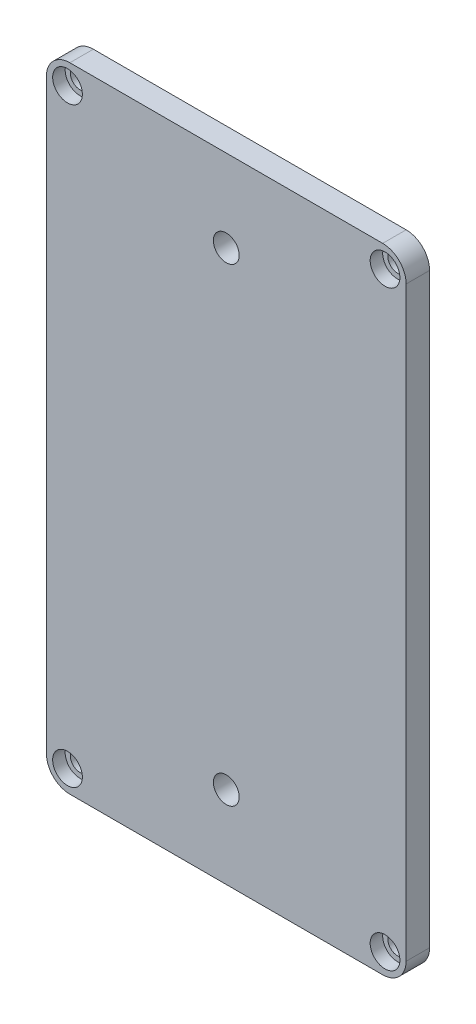
from build123d import *

# Parameters (mm, degrees)
SKETCH1_W           = 46
SKETCH1_H           = 81
SKETCH1_R           = 1.25
BOSS_EXTRUDE1_DEPTH = 3
FILLET1_R           = 3
SKETCH4_R           = 1.9
CUT_EXTRUDE2_DEPTH  = 1.6
SKETCH5_R           = 1.65
CUT_EXTRUDE3_DEPTH  = 10


with BuildPart() as part:
    # Sketch1 → Boss-Extrude1 (new body)
    with BuildSketch(Plane.XY):
        Rectangle(SKETCH1_W, SKETCH1_H)
        with Locations((-20.3, 37.8)):
            Circle(SKETCH1_R, mode=Mode.SUBTRACT)
        with Locations(Location((20.3, 37.8, 0), (0, 0, 180))):
            Circle(SKETCH1_R, mode=Mode.SUBTRACT)
        with Locations((20.3, -37.8)):
            Circle(SKETCH1_R, mode=Mode.SUBTRACT)
        with Locations(Location((-20.3, -37.8, 0), (0, 0, 180))):
            Circle(SKETCH1_R, mode=Mode.SUBTRACT)
    extrude(amount=BOSS_EXTRUDE1_DEPTH)

    # Fillet1
    fillet1_edges = [part.edges().sort_by_distance(p)[0] for p in [
        (23, -40.5, 1.5),
        (-23, -40.5, 1.5),
        (-23, 40.5, 1.5),
        (23, 40.5, 1.5),
    ]]
    fillet(fillet1_edges, radius=FILLET1_R)

    # Sketch4 → Cut-Extrude2 (cut)
    with BuildSketch(Plane.XY.offset(3)):
        with Locations((20.3, 37.8)):
            Circle(SKETCH4_R)
        with Locations(Location((-20.3, 37.8, 0), (0, 0, 180))):
            Circle(SKETCH4_R)
        with Locations((-20.3, -37.8)):
            Circle(SKETCH4_R)
        with Locations(Location((20.3, -37.8, 0), (0, 0, 180))):
            Circle(SKETCH4_R)
    extrude(amount=-CUT_EXTRUDE2_DEPTH, mode=Mode.SUBTRACT)

    # Sketch5 → Cut-Extrude3 (cut)
    with BuildSketch(Plane.XY.offset(3)):
        with Locations((0, 30)):
            Circle(SKETCH5_R)
        with Locations(Location((0, -30, 0), (0, 0, 180))):
            Circle(SKETCH5_R)
    extrude(amount=-CUT_EXTRUDE3_DEPTH, mode=Mode.SUBTRACT)


solid = part.part
